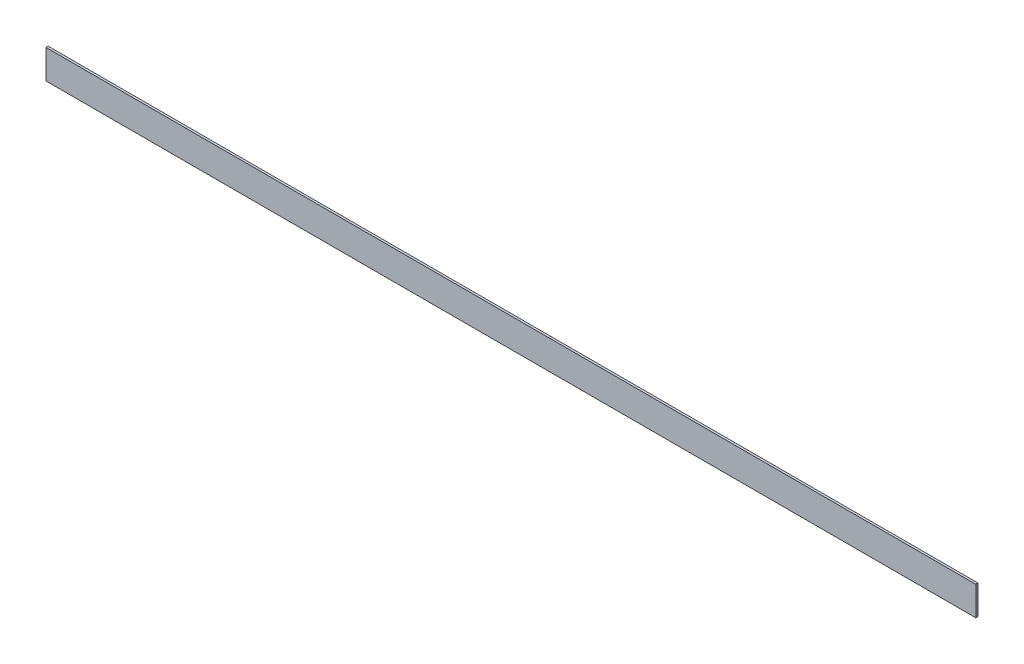
from build123d import *

# Parameters (mm, degrees)
OVEN_PANEL_UST_SERIT_1_START = 38.5
SKETCH1_W                    = 640
SKETCH1_H                    = 20
OVEN_PANEL_UST_SERIT_1_DEPTH = 1.5


with BuildPart() as part:
    # Sketch1 → OVEN_panel_ust_serit_1 (new body)
    with BuildSketch(Plane.XY.offset(OVEN_PANEL_UST_SERIT_1_START)):
        with Locations((350, 1960)):
            Rectangle(SKETCH1_W, SKETCH1_H)
    extrude(amount=OVEN_PANEL_UST_SERIT_1_DEPTH)


solid = part.part
